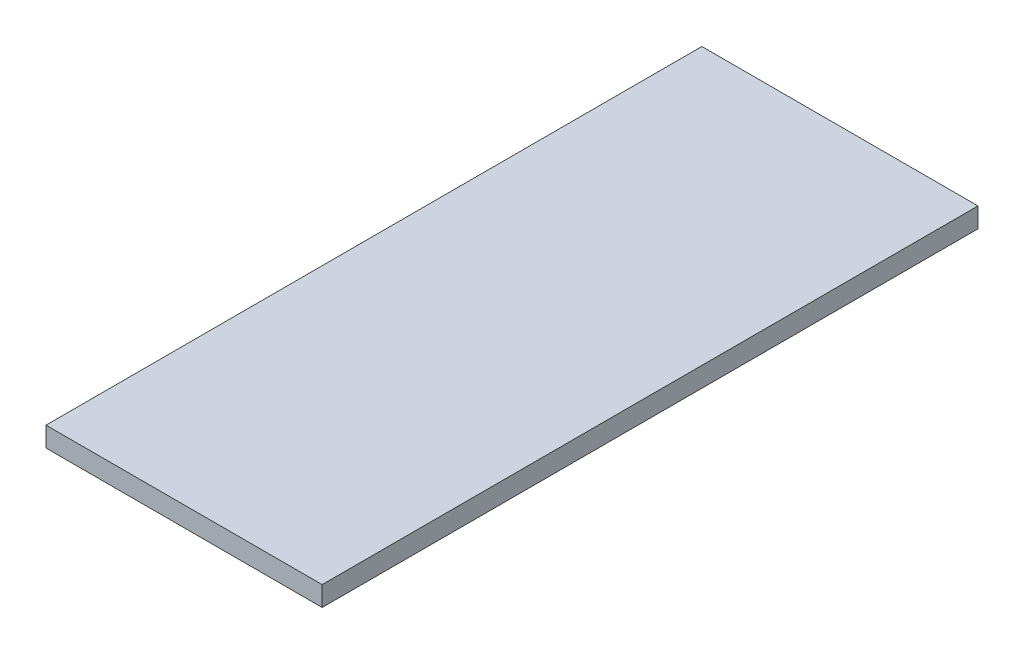
from build123d import *

# Parameters (mm, degrees)
SKETCH_S_W          = 254
SKETCH_S_H          = 603.25
BOSS_EXTRUDE1_DEPTH = 18.25625


with BuildPart() as part:
    # Sketch s → Boss-Extrude1 (new body)
    with BuildSketch(Plane(origin=(0, 0, 0), x_dir=(1, 0, 0), z_dir=(0, 1, 0))):
        with Locations((0, 301.625)):
            Rectangle(SKETCH_S_W, SKETCH_S_H)
    extrude(amount=BOSS_EXTRUDE1_DEPTH)


solid = part.part
